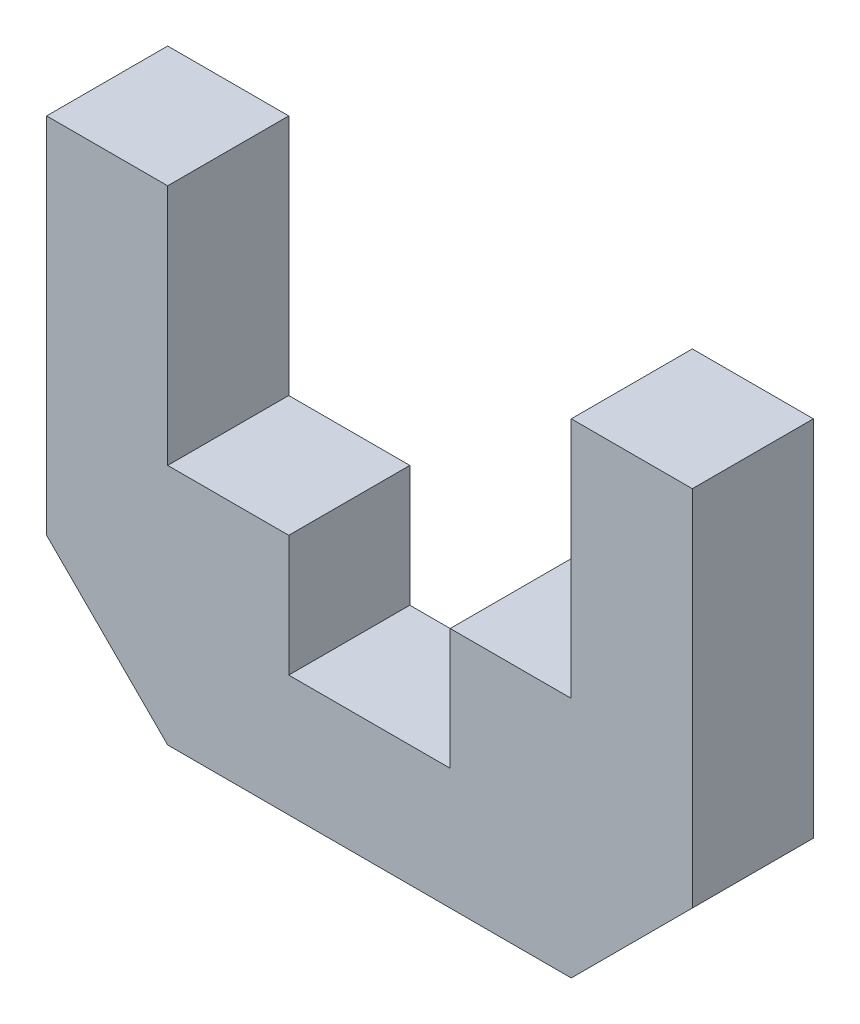
from build123d import *

# Parameters (mm, degrees)
EXTRUDE_1_DEPTH = 3


with BuildPart() as part:
    # 草图1 → 凸台-拉伸1 (new body)
    with BuildSketch(Plane.XY):
        Polygon((2, 0), (-2, 0), (-2, 3), (-5, 3), (-5, 9), (-8, 9), (-8, 0), (-5, -3), (5, -3), (8, 0), (8, 9), (5, 9), (5, 3), (2, 3), align=None)
    extrude(amount=EXTRUDE_1_DEPTH)


solid = part.part
